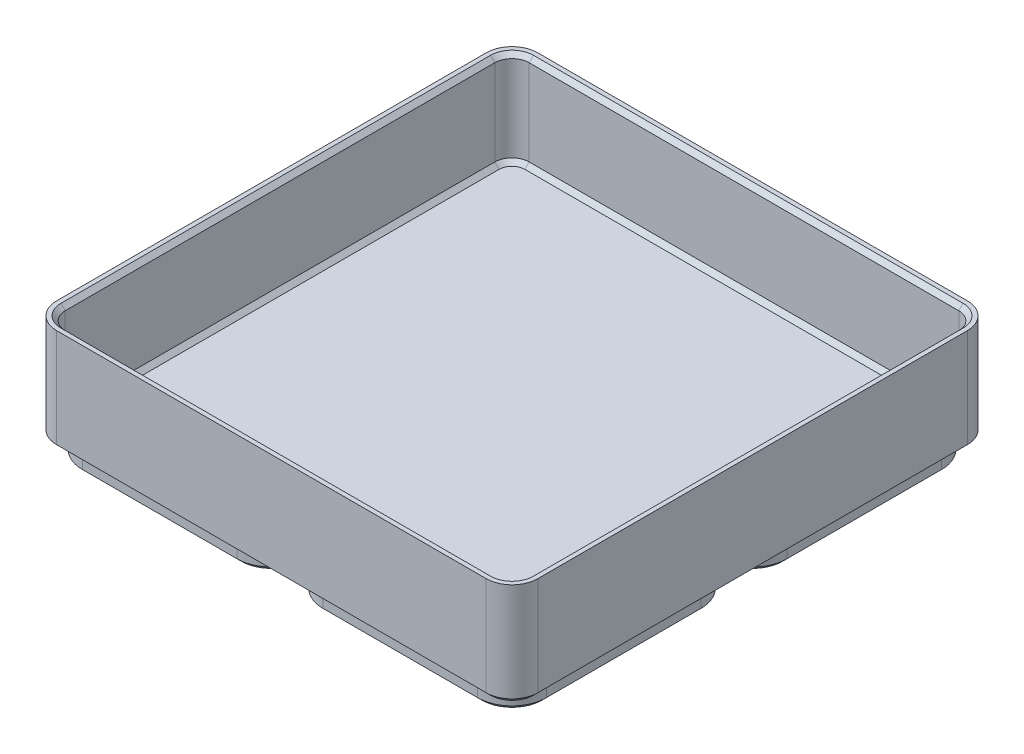
from build123d import *

# Parameters (mm, degrees)
BOSS_EXTRUDE4_DEPTH = 5
SKETCH6_W           = 70
SKETCH6_H           = 70
BOSS_EXTRUDE5_DEPTH = 30
SKETCH8_R           = 3
CUT_EXTRUDE1_DEPTH  = 2
FILLET1_R           = 7.5
CUT_EXTRUDE2_DEPTH  = 27.5
CHAMFER1_SIZE       = 1.25
CHAMFER2_SIZE       = 1.25


with BuildPart() as part:
    # Sketch5 → Boss-Extrude4 (new body)
    with BuildSketch(Plane(origin=(0, 0, 0), x_dir=(1, 0, 0), z_dir=(0, 1, 0))):
        with BuildLine():
            Line((-22.5, -32.5), (22.5, -32.5))
            ThreePointArc((22.5, -32.5), (29.571067812, -29.571067812), (32.5, -22.5))
            Line((32.5, -22.5), (32.5, 22.5))
            ThreePointArc((32.5, 22.5), (29.571067812, 29.571067812), (22.5, 32.5))
            Line((22.5, 32.5), (-22.5, 32.5))
            ThreePointArc((-22.5, 32.5), (-29.571067812, 29.571067812), (-32.5, 22.5))
            Line((-32.5, 22.5), (-32.5, -22.5))
            ThreePointArc((-32.5, -22.5), (-29.571067812, -29.571067812), (-22.5, -32.5))
        make_face()
    extrude(amount=BOSS_EXTRUDE4_DEPTH)

    # Sketch6 → Boss-Extrude5 (add)
    with BuildSketch(Plane(origin=(0, 5, 0), x_dir=(1, 0, 0), z_dir=(0, 1, 0))):
        Rectangle(SKETCH6_W, SKETCH6_H)
    extrude(amount=BOSS_EXTRUDE5_DEPTH)

    # Sketch8 → Cut-Extrude1 (cut)
    with BuildSketch(Plane.XZ):
        with Locations(Location((26.037533906, -26.035533906, 0), (0, 0, 270))):
            Circle(SKETCH8_R)
        with Locations(Location((26.036533906, 26.036533906, 0), (0, 0, 270))):
            Circle(SKETCH8_R)
        with BuildLine():
            ThreePointArc((-23.035533906, 26.035533906), (-24.887483609, 28.807172503), (-28.156854249, 28.156854249))
            Line((-28.156854249, 28.156854249), (-23.914213562, 23.914213562))
            ThreePointArc((-23.914213562, 23.914213562), (-23.263895308, 24.887483609), (-23.035533906, 26.035533906))
        make_face()
        with BuildLine():
            Line((-23.914213562, 23.914213562), (-28.156854249, 28.156854249))
            ThreePointArc((-28.156854249, 28.156854249), (-28.156854249, 23.914213562), (-23.914213562, 23.914213562))
        make_face()
        with Locations(Location((-26.034533906, -26.036533906, 0), (0, 0, 270))):
            Circle(SKETCH8_R)
    extrude(amount=-CUT_EXTRUDE1_DEPTH, mode=Mode.SUBTRACT)

    # Mirror1: part across plane


with BuildPart() as part_1:
    add(part.part)
    add(part.part.mirror(Plane(origin=(-35, 35, -35), x_dir=(0, 0, 1), z_dir=(1, 0, 0))))

    # Mirror2: part across plane


with BuildPart() as part_2:
    add(part_1.part)
    add(part_1.part.mirror(Plane(origin=(35, 35, 35), x_dir=(1, 0, 0), z_dir=(0, 0, -1))))

    # Fillet1
    fillet1_edges = [part_2.edges().sort_by_distance(p)[0] for p in [
        (35, 20, 105),
        (-105, 20, 105),
        (35, 20, -35),
        (-105, 20, -35),
    ]]
    fillet(fillet1_edges, radius=FILLET1_R)

    # Sketch11 → Cut-Extrude2 (cut)
    with BuildSketch(Plane(origin=(0, 35, 0), x_dir=(1, 0, 0), z_dir=(0, 1, 0))):
        with BuildLine():
            Line((32.5, -97.5), (32.5, 27.5))
            ThreePointArc((32.5, 27.5), (31.035533906, 31.035533906), (27.5, 32.5))
            Line((27.5, 32.5), (-97.5, 32.5))
            ThreePointArc((-97.5, 32.5), (-101.035533906, 31.035533906), (-102.5, 27.5))
            Line((-102.5, 27.5), (-102.5, -97.5))
            ThreePointArc((-102.5, -97.5), (-101.035533906, -101.035533906), (-97.5, -102.5))
            Line((-97.5, -102.5), (27.5, -102.5))
            ThreePointArc((27.5, -102.5), (31.035533906, -101.035533906), (32.5, -97.5))
        make_face()
    extrude(amount=-CUT_EXTRUDE2_DEPTH, mode=Mode.SUBTRACT)

    # Chamfer1
    chamfer1_edges = [part_2.edges().sort_by_distance(p)[0] for p in [
        (31.035533906, 7.5, -31.035533906),
        (32.5, 7.5, 35),
        (31.035533906, 7.5, 101.035533906),
        (-35, 7.5, 102.5),
        (-101.035533906, 7.5, 101.035533906),
        (-102.5, 7.5, 35),
        (-101.035533906, 7.5, -31.035533906),
        (-35, 7.5, -32.5),
        (31.035533906, 35, -31.035533906),
        (-35, 35, -32.5),
        (-101.035533906, 35, -31.035533906),
        (-102.5, 35, 35),
        (-101.035533906, 35, 101.035533906),
        (-35, 35, 102.5),
        (31.035533906, 35, 101.035533906),
        (32.5, 35, 35),
    ]]
    chamfer(chamfer1_edges, length=CHAMFER1_SIZE)

    # Chamfer2
    chamfer2_edges = [part_2.edges().sort_by_distance(p)[0] for p in [
        (32.5, 0, 0),
        (29.571067812, 0, 29.571067812),
        (0, 0, 32.5),
        (-29.571067812, 0, 29.571067812),
        (-29.571067812, 0, 40.428932188),
        (0, 0, 37.5),
        (29.571067812, 0, 40.428932188),
        (32.5, 0, 70),
        (29.571067812, 0, 99.571067812),
        (0, 0, 102.5),
        (-29.571067812, 0, 99.571067812),
        (-32.5, 0, 70),
        (-40.428932188, 0, 40.428932188),
        (-70, 0, 37.5),
        (-99.571067812, 0, 40.428932188),
        (-102.5, 0, 70),
        (-99.571067812, 0, 99.571067812),
        (-70, 0, 102.5),
        (-40.428932188, 0, 99.571067812),
        (-37.5, 0, 70),
        (-35, 5, -35),
        (35, 5, 35),
        (-35, 5, 105),
        (-105, 5, 35),
        (-102.803300859, 5, 102.803300859),
        (-102.803300859, 5, -32.803300859),
        (32.803300859, 5, 102.803300859),
        (32.803300859, 5, -32.803300859),
        (-40.428932188, 0, 29.571067812),
        (-70, 0, 32.5),
        (-99.571067812, 0, 29.571067812),
        (-102.5, 0, 0),
        (-99.571067812, 0, -29.571067812),
        (-70, 0, -32.5),
        (-40.428932188, 0, -29.571067812),
        (-37.5, 0, 0),
        (-32.5, 0, 0),
        (-29.571067812, 0, -29.571067812),
        (0, 0, -32.5),
        (29.571067812, 0, -29.571067812),
    ]]
    chamfer(chamfer2_edges, length=CHAMFER2_SIZE)


solid = part_2.part
